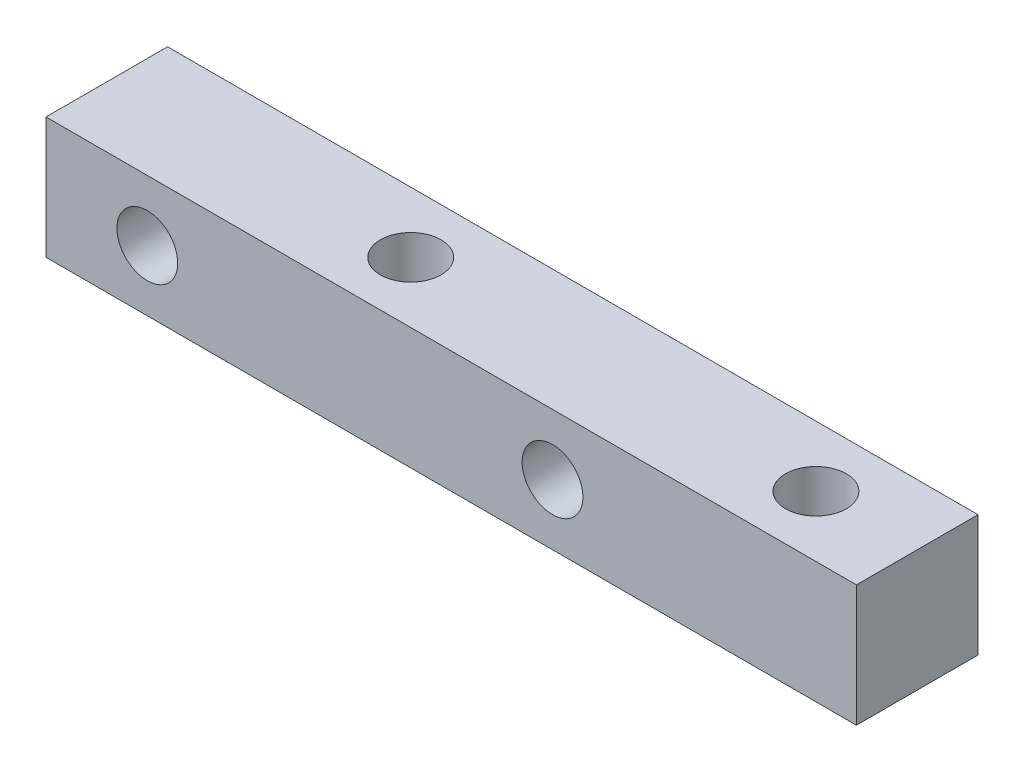
from build123d import *

# Parameters (mm, degrees)
SKETCH_1_W          = 40
SKETCH_1_H          = 6
EXTRUDE_1_DEPTH     = 6
SKETCH_2_R          = 1.5
CUT_EXTRUDE_1_DEPTH = 6
SKETCH_3_R          = 1.5
CUT_EXTRUDE_2_DEPTH = 6


with BuildPart() as part:
    # 草图1 → 凸台-拉伸1 (new body)
    with BuildSketch(Plane.XY):
        Rectangle(SKETCH_1_W, SKETCH_1_H)
    extrude(amount=EXTRUDE_1_DEPTH)

    # 草图2 → 切除-拉伸1 (cut)
    with BuildSketch(Plane.XY.offset(6)):
        with Locations((-15, 0)):
            Circle(SKETCH_2_R)
        with Locations((5, 0)):
            Circle(SKETCH_2_R)
    extrude(amount=-CUT_EXTRUDE_1_DEPTH, mode=Mode.SUBTRACT)

    # 草图3 → 切除-拉伸2 (cut)
    with BuildSketch(Plane(origin=(0, 3, 0), x_dir=(1, 0, 0), z_dir=(0, 1, 0))):
        with Locations(Location((15, -3, 0), (0, 0, 270))):
            Circle(SKETCH_3_R)
        with Locations(Location((-5, -3, 0), (0, 0, 270))):
            Circle(SKETCH_3_R)
    extrude(amount=-CUT_EXTRUDE_2_DEPTH, mode=Mode.SUBTRACT)


solid = part.part
